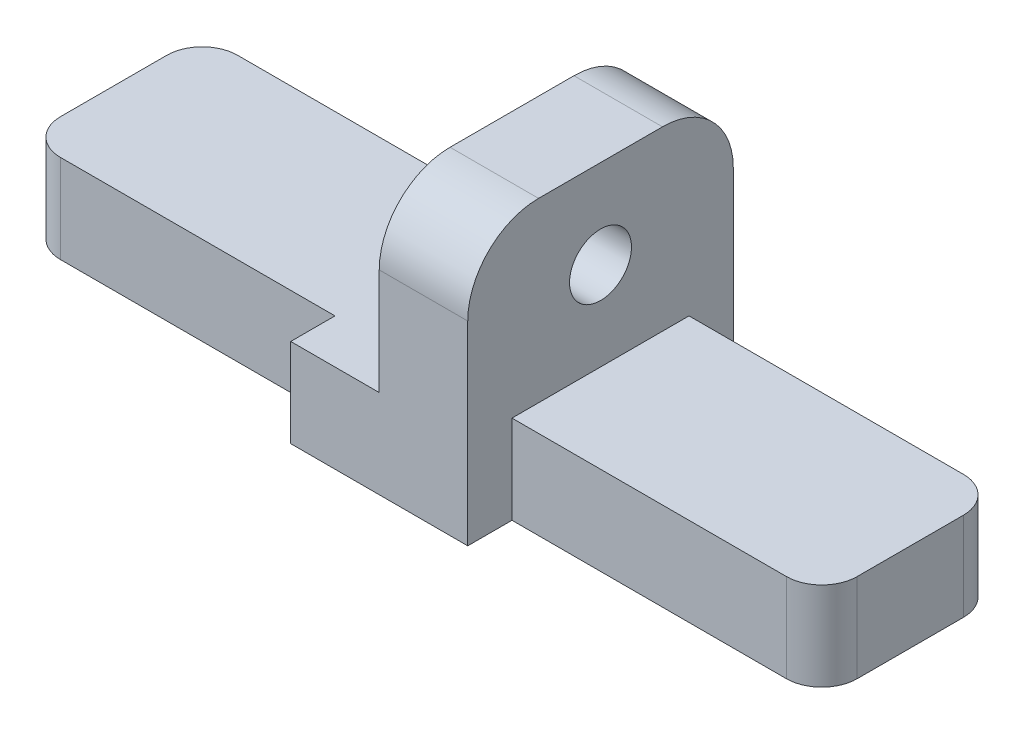
from build123d import *

# Parameters (mm, degrees)
SKETCH_3_W                  = 45
SKETCH_3_H                  = 10
EXTRUDE_2_DEPTH             = 5
SKETCH_4_W                  = 10
SKETCH_4_H                  = 15
EXTRUDE_3_DEPTH             = 10
EXTRUDE_3_DIRECTION_2_REACH = 25.585
SKETCH_5_R                  = 1.75
CUT_EXTRUDE_1_DEPTH         = 10
FILLET_2_R                  = 2
FILLET_1_R                  = 4
SKETCH_8_W                  = 20
SKETCH_8_H                  = 10
CUT_EXTRUDE_2_DEPTH         = 5


with BuildPart() as part:
    # 草图3 → 凸台-拉伸2 (new body)
    with BuildSketch(Plane(origin=(0, 0, 0), x_dir=(1, 0, 0), z_dir=(0, 1, 0))):
        Rectangle(SKETCH_3_W, SKETCH_3_H)
    extrude(amount=EXTRUDE_2_DEPTH)

    # 草图4 → 凸台-拉伸3 (add)
    with BuildSketch(Plane(origin=(0, 5, 0), x_dir=(1, 0, 0), z_dir=(0, 1, 0))):
        Rectangle(SKETCH_4_W, SKETCH_4_H)
    extrude(amount=EXTRUDE_3_DEPTH)

    # 凸台-拉伸3 direction 2: up to this face of the body (flat: up to its plane)
    extrude_3_direction_2_end = Plane(part.part.faces().sort_by_distance((0, 0, 0))[0])
    # 草图4 → 凸台-拉伸3 direction 2 (add, up to the picked face)
    with BuildSketch(Plane(origin=(0, 5, 0), x_dir=(1, 0, 0), z_dir=(0, 1, 0)), mode=Mode.PRIVATE) as extrude_3_direction_2_sk1:
        Rectangle(SKETCH_4_W, SKETCH_4_H)
    extrude_3_direction_2_tool1 = split(extrude(extrude_3_direction_2_sk1.sketch, amount=-EXTRUDE_3_DIRECTION_2_REACH, mode=Mode.PRIVATE), bisect_by=extrude_3_direction_2_end, keep=Keep.BOTH, mode=Mode.PRIVATE)
    add(extrude_3_direction_2_tool1.solids().sort_by(Axis((0, 5, 0), (0, -1, 0)))[0])

    # 草图5 → 切除-拉伸1 (cut)
    with BuildSketch(Plane.ZY.offset(5)):
        with Locations((0, 10)):
            Circle(SKETCH_5_R)
    extrude(amount=-CUT_EXTRUDE_1_DEPTH, mode=Mode.SUBTRACT)

    # 圆角2
    fillet_2_edges = [part.edges().sort_by_distance(p)[0] for p in [
        (22.5, 2.5, 5),
        (-22.5, 2.5, 5),
        (-22.5, 2.5, -5),
        (22.5, 2.5, -5),
    ]]
    fillet(fillet_2_edges, radius=FILLET_2_R)

    # 圆角1
    fillet_1_edges = [part.edges().sort_by_distance(p)[0] for p in [
        (0, 15, -7.5),
        (0, 15, 7.5),
    ]]
    fillet(fillet_1_edges, radius=FILLET_1_R)

    # 草图8 → 切除-拉伸2 (cut)
    with BuildSketch(Plane.ZY.offset(5)):
        with Locations((0, 10)):
            Rectangle(SKETCH_8_W, SKETCH_8_H)
    extrude(amount=-CUT_EXTRUDE_2_DEPTH, mode=Mode.SUBTRACT)


solid = part.part
